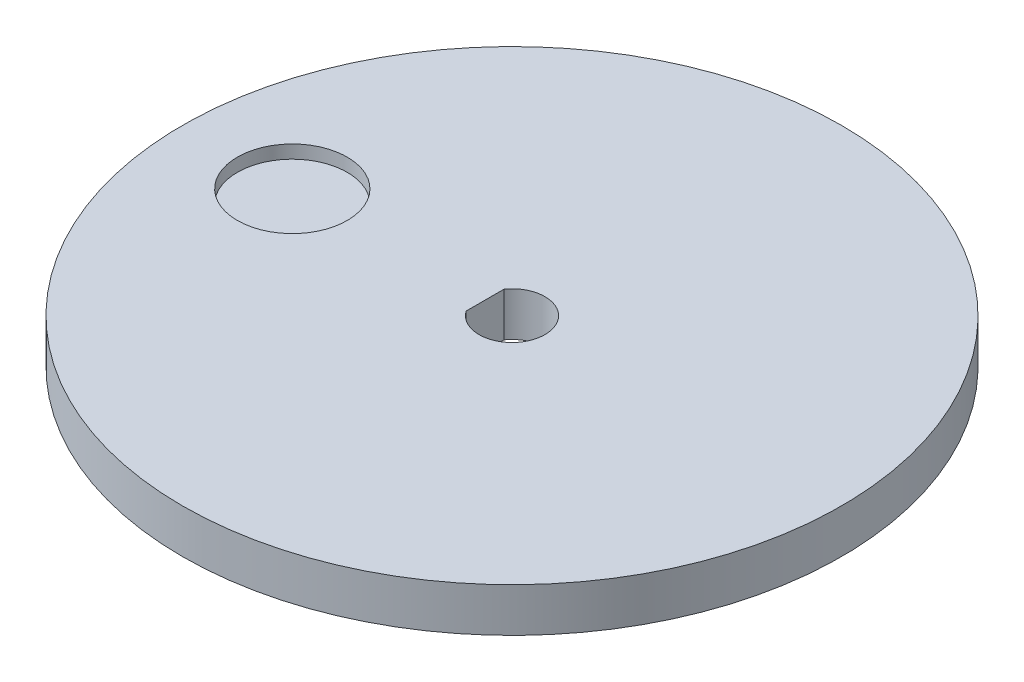
from build123d import *

# Parameters (mm, degrees)
SKETCH1_R           = 30
BOSS_EXTRUDE1_DEPTH = 4
SKETCH2_R           = 5
CUT_EXTRUDE1_DEPTH  = 1.2


with BuildPart() as part:
    # Sketch1 → Boss-Extrude1 (new body)
    with BuildSketch(Plane(origin=(0, 0, 0), x_dir=(1, 0, 0), z_dir=(0, 1, 0))):
        with Locations(Location((0, 0, 0), (0, 0, 270))):
            Circle(SKETCH1_R)
        with BuildLine():
            Line((-2.45, 1.731328969), (-2.45, 0))
            Line((-2.45, 0), (-2.45, -1.731328969))
            ThreePointArc((-2.45, -1.731328969), (3, 0), (-2.45, 1.731328969))
        make_face(mode=Mode.SUBTRACT)
    extrude(amount=BOSS_EXTRUDE1_DEPTH)

    # Sketch2 → Cut-Extrude1 (cut)
    with BuildSketch(Plane(origin=(0, 4, 0), x_dir=(1, 0, 0), z_dir=(0, 1, 0))):
        with Locations(Location((-20, 0, 0), (0, 0, 270))):
            Circle(SKETCH2_R)
    extrude(amount=-CUT_EXTRUDE1_DEPTH, mode=Mode.SUBTRACT)


solid = part.part
